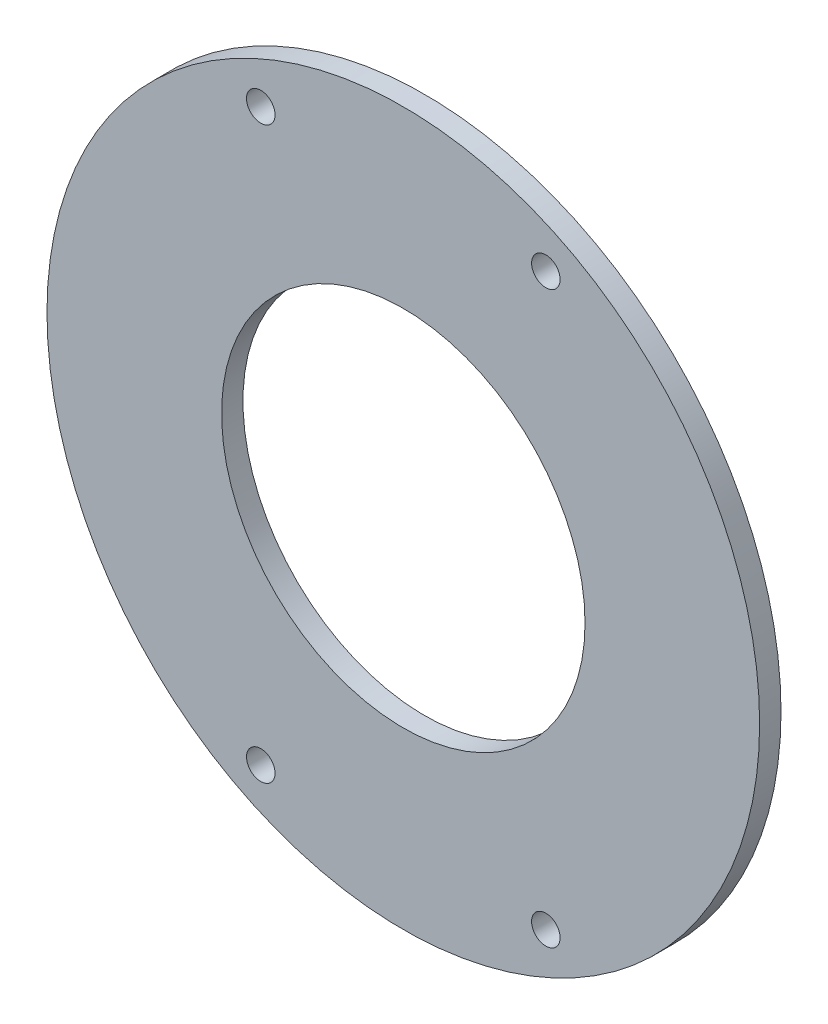
from build123d import *

# Parameters (mm, degrees)
SKETCH_1_R      = 50
SKETCH_1_R_2    = 2
SKETCH_1_R_3    = 25.5
EXTRUDE_1_DEPTH = 3


with BuildPart() as part:
    # 草图1 → 凸台-拉伸1 (new body)
    with BuildSketch(Plane.XY):
        with Locations((0, -21.854285714)):
            Circle(SKETCH_1_R)
        with Locations((-20, 18.145714286)):
            Circle(SKETCH_1_R_2, mode=Mode.SUBTRACT)
        with Locations((20, 18.145714286)):
            Circle(SKETCH_1_R_2, mode=Mode.SUBTRACT)
        with Locations(Location((20, -61.854285714, 0), (0, 0, 180))):
            Circle(SKETCH_1_R_2, mode=Mode.SUBTRACT)
        with Locations(Location((-20, -61.854285714, 0), (0, 0, 180))):
            Circle(SKETCH_1_R_2, mode=Mode.SUBTRACT)
        with Locations((0, -21.854285714)):
            Circle(SKETCH_1_R_3, mode=Mode.SUBTRACT)
    extrude(amount=EXTRUDE_1_DEPTH)


solid = part.part
